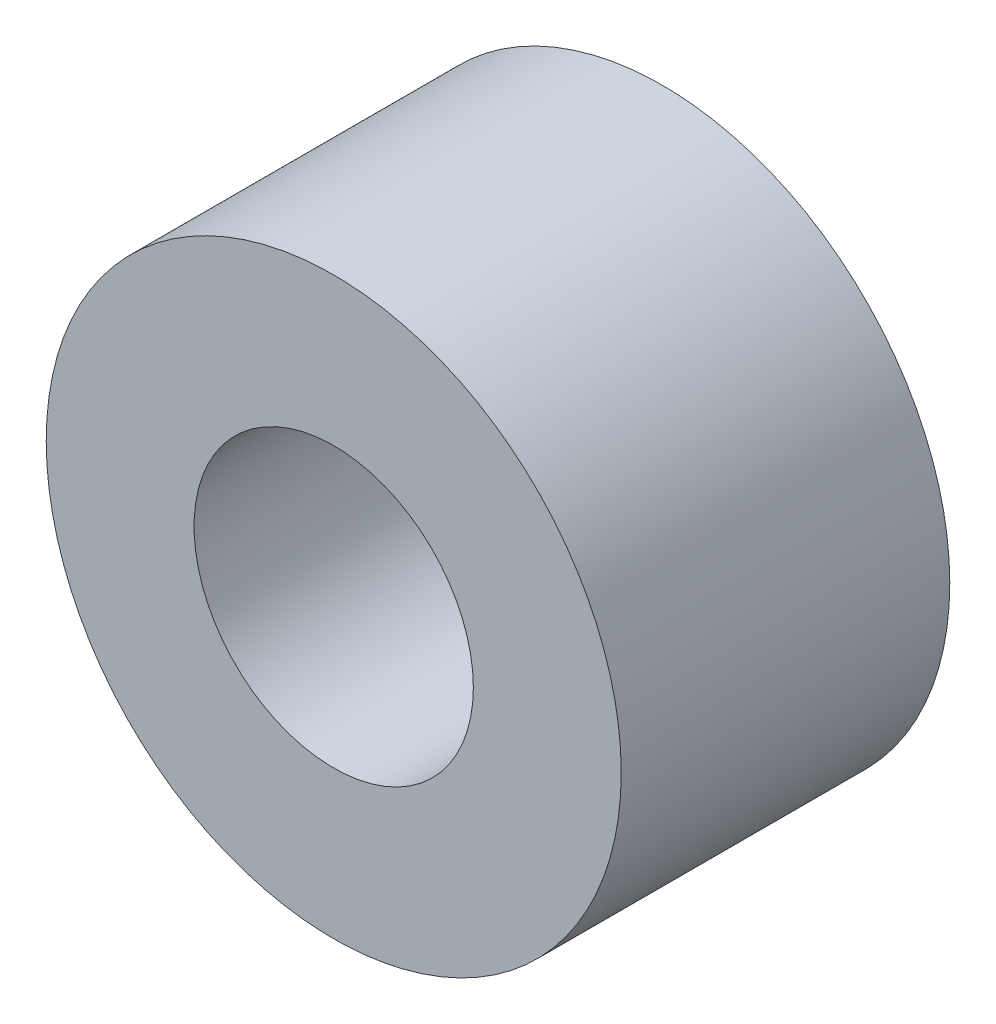
from build123d import *

# Parameters (mm, degrees)
SKETCH1_R           = 3.5
SKETCH1_R_2         = 1.7
BOSS_EXTRUDE1_DEPTH = 4


with BuildPart() as part:
    # Sketch1 → Boss-Extrude1 (new body)
    with BuildSketch(Plane.XY):
        Circle(SKETCH1_R)
        Circle(SKETCH1_R_2, mode=Mode.SUBTRACT)
    extrude(amount=BOSS_EXTRUDE1_DEPTH)


solid = part.part
